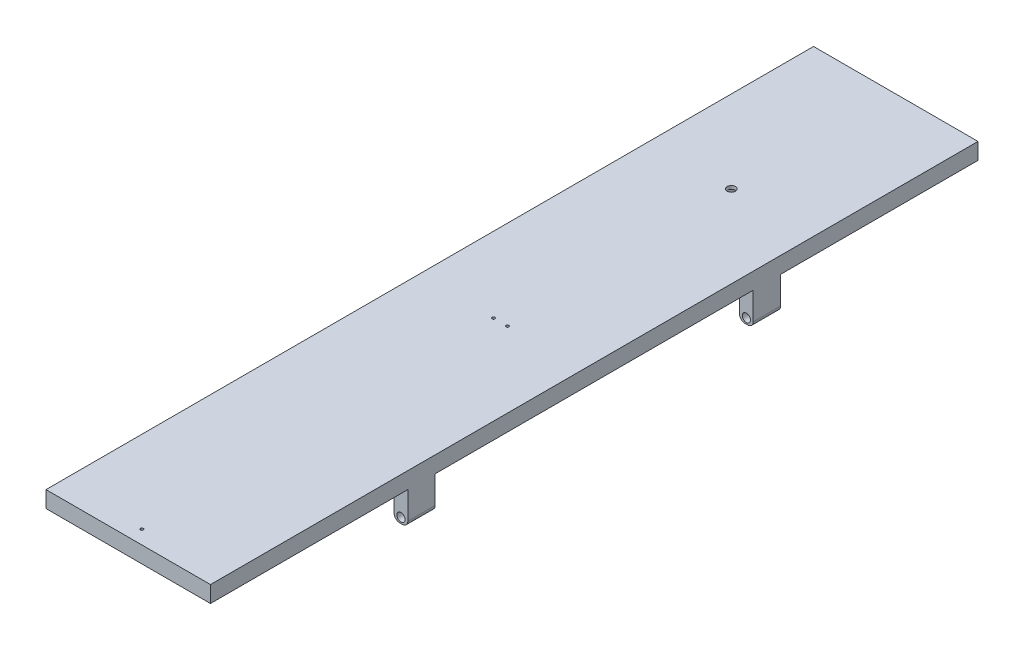
from build123d import *

# Parameters (mm, degrees)
BOSS_EXTRUDE1_DEPTH      = 1100
BOSS_EXTRUDE1_DEPTH_BACK = 300
SKETCH1_R                = 7.5
CUT_EXTRUDE1_DEPTH       = 1142.753038095
CUT_EXTRUDE1_DEPTH_BACK  = 1142.753038095
SKETCH3_W                = 360
SKETCH3_H                = 60
SKETCH4_R                = 7.5
CUT_EXTRUDE2_DEPTH       = 1144.721994193
SKETCH7_W                = 25
SKETCH7_H                = 32
BOSS_EXTRUDE2_DEPTH      = 37.5
SKETCH8_W                = 16
SKETCH8_H                = 32.5
CUT_EXTRUDE4_DEPTH       = 1127.346305538
SKETCH9_W                = 16
SKETCH9_H                = 64
CUT_EXTRUDE5_DEPTH       = 24
SKETCH10_R               = 2.5908
CUT_EXTRUDE6_DEPTH       = 20


with BuildPart() as part:
    # Sketch1 → Boss-Extrude1 (new, two sides: drawn at the far end of the back side and taken through both)
    with BuildSketch(Plane.XY.offset(-BOSS_EXTRUDE1_DEPTH_BACK)):
        with BuildLine():
            Line((0, 0), (0, 30))
            Line((0, 30), (-300, 30))
            Line((-300, 30), (-300, 0))
            Line((-300, 0), (-300, -50))
            ThreePointArc((-300, -50), (-297.071067812, -57.071067812), (-290, -60))
            Line((-290, -60), (-285, -60))
            ThreePointArc((-285, -60), (-277.928932188, -57.071067812), (-275, -50))
            Line((-275, -50), (-275, 0))
            Line((-275, 0), (-25, 0))
            Line((-25, 0), (-25, -50))
            ThreePointArc((-25, -50), (-22.071067812, -57.071067812), (-15, -60))
            Line((-15, -60), (-10, -60))
            ThreePointArc((-10, -60), (-2.928932188, -57.071067812), (0, -50))
            Line((0, -50), (0, 0))
        make_face()
        with Locations((-12.5, -50)):
            Circle(SKETCH1_R, mode=Mode.SUBTRACT)
        with Locations(Location((-287.5, -50, 0), (0, 0, 180))):
            Circle(SKETCH1_R, mode=Mode.SUBTRACT)
    extrude(amount=BOSS_EXTRUDE1_DEPTH + BOSS_EXTRUDE1_DEPTH_BACK)

    # Sketch3 → Cut-Extrude1 (cut, two sides: drawn at the far end of the back side and taken through both)
    with BuildSketch(Plane(origin=(0, 0, 0), x_dir=(0, 0, -1), z_dir=(1, 0, 0)).offset(-CUT_EXTRUDE1_DEPTH_BACK)):
        with Locations((-920, -30)):
            Rectangle(SKETCH3_W, SKETCH3_H)
        Polygon((0, 0), (300, 0), (300, -60), (0, -60), (-60, -60), (-60, 0), align=None)
        Polygon((-690, -60), (-110, -60), (-110, -50), (-110, 0), (-690, 0), (-690, -50), align=None)
    extrude(amount=CUT_EXTRUDE1_DEPTH + CUT_EXTRUDE1_DEPTH_BACK, mode=Mode.SUBTRACT)

    # Sketch4 → Cut-Extrude2 (cut, through all)
    with BuildSketch(Plane(origin=(0, 30, 0), x_dir=(1, 0, 0), z_dir=(0, 1, 0))):
        with Locations(Location((-150, 0, 0), (0, 0, 180))):
            Circle(SKETCH4_R)
    extrude(amount=-CUT_EXTRUDE2_DEPTH, mode=Mode.SUBTRACT)

    # Sketch7 → Boss-Extrude2 (add)
    with BuildSketch(Plane(origin=(0, 0, 0), x_dir=(-1, 0, 0), z_dir=(0, -1, 0))):
        with Locations((150, 0)):
            Rectangle(SKETCH7_W, SKETCH7_H)
    extrude(amount=BOSS_EXTRUDE2_DEPTH)

    # Sketch8 → Cut-Extrude4 (cut, through all)
    with BuildSketch(Plane.XY.offset(16)):
        with Locations((-150, -16.25)):
            Rectangle(SKETCH8_W, SKETCH8_H)
    extrude(amount=-CUT_EXTRUDE4_DEPTH, mode=Mode.SUBTRACT)

    # Sketch9 → Cut-Extrude5 (cut)
    with BuildSketch(Plane.XZ):
        with Locations((-150, 0)):
            Rectangle(SKETCH9_W, SKETCH9_H)
    extrude(amount=-CUT_EXTRUDE5_DEPTH, mode=Mode.SUBTRACT)

    # Sketch10 → Cut-Extrude6 (cut)
    with BuildSketch(Plane(origin=(0, 30, 0), x_dir=(1, 0, 0), z_dir=(0, 1, 0))):
        with Locations(Location((-150, -1075, 0), (0, 0, 180))):
            Circle(SKETCH10_R)
        with Locations(Location((-162.7, -420.95, 0), (0, 0, 180))):
            Circle(SKETCH10_R)
        with Locations(Location((-137.3, -420.95, 0), (0, 0, 180))):
            Circle(SKETCH10_R)
    extrude(amount=-CUT_EXTRUDE6_DEPTH, mode=Mode.SUBTRACT)


solid = part.part
